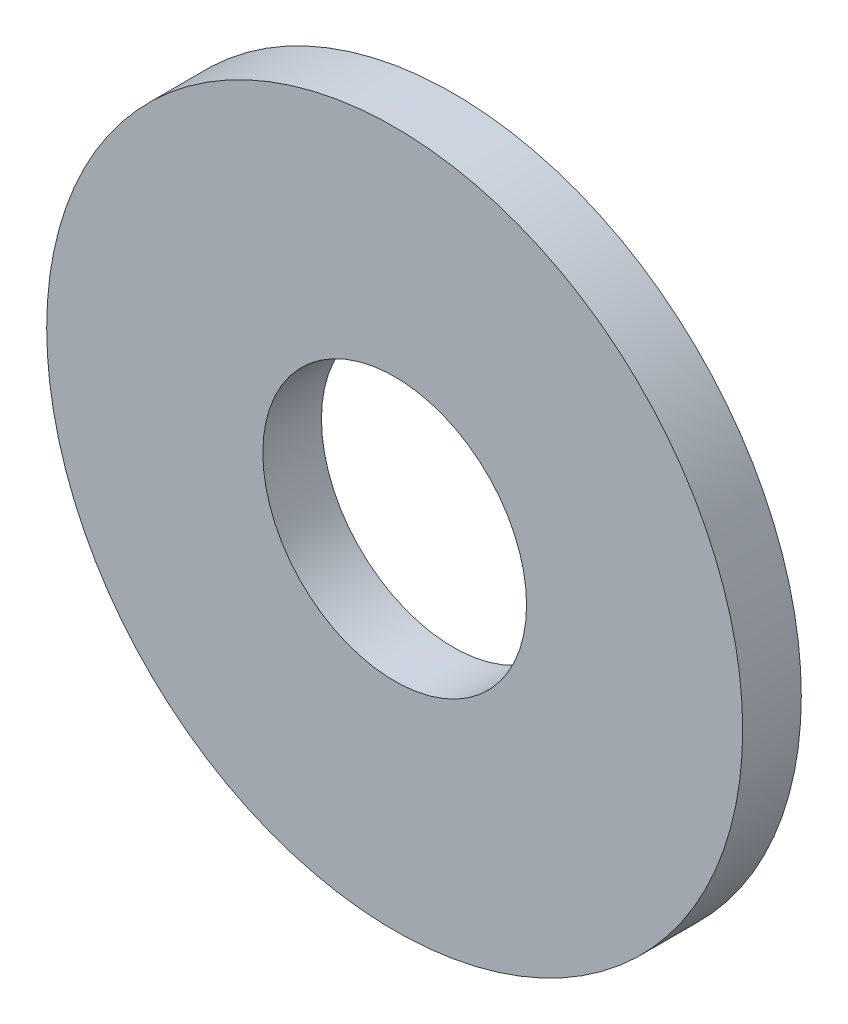
from build123d import *

# Parameters (mm, degrees)
SKETCH1_W = 0.8
SKETCH1_H = 2.95


with BuildPart() as part:
    # Sketch1 → Revolve1 (revolve)
    with BuildSketch(Plane(origin=(0, 0, 0), x_dir=(0, 0, -1), z_dir=(1, 0, 0)), mode=Mode.PRIVATE) as revolve1_sk:
        with Locations((0.4, 3.275)):
            Rectangle(SKETCH1_W, SKETCH1_H)
    revolve(revolve1_sk.sketch.rotate(Axis((0, 0, 0), (0, 0, -1)), 90), axis=Axis((0, 0, 0), (0, 0, -1)))


solid = part.part
